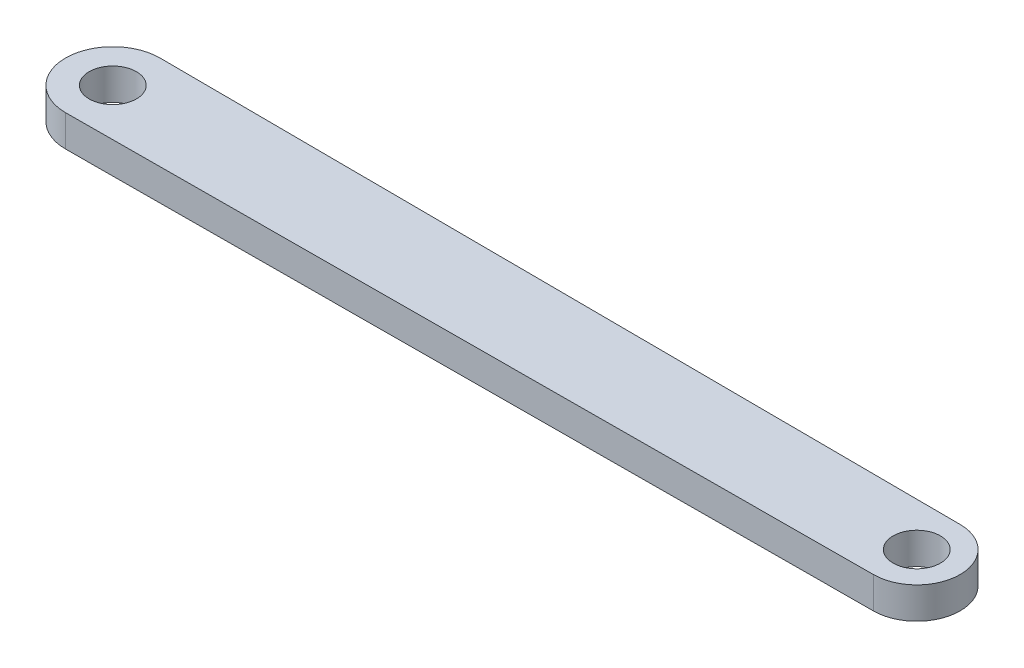
from build123d import *

# Parameters (mm, degrees)
SKETCH1_R           = 1.5
BOSS_EXTRUDE1_DEPTH = 20
SKETCH2_R           = 1.5
BOSS_EXTRUDE2_DEPTH = 1
SKETCH3_R           = 1.5
CUT_EXTRUDE1_DEPTH  = 68.268120235


with BuildPart() as part:
    # Sketch1 → Boss-Extrude1 (new, symmetric)
    with BuildSketch(Plane(origin=(0, 0, 0), x_dir=(1, 0, 0), z_dir=(0, 1, 0))):
        with Locations(Location((0, 0, 0), (0, 0, 270))):
            Circle(SKETCH1_R)
    extrude(amount=BOSS_EXTRUDE1_DEPTH, both=True)

    # Sketch2 → Boss-Extrude2 (add, symmetric)
    with BuildSketch(Plane(origin=(0, 0, 0), x_dir=(1, 0, 0), z_dir=(0, 1, 0))):
        with BuildLine():
            Line((-50.985294118, 2.999963956), (0.013480392, 2.74996696))
            ThreePointArc((0.013480392, 2.74996696), (2.75, 0), (0.013480392, -2.74996696))
            Line((0.013480392, -2.74996696), (-50.985294118, -2.999963956))
            ThreePointArc((-50.985294118, -2.999963956), (-54, 0), (-50.985294118, 2.999963956))
        make_face()
        with Locations(Location((-51, 0, 0), (0, 0, 270))):
            Circle(SKETCH2_R, mode=Mode.SUBTRACT)
    extrude(amount=BOSS_EXTRUDE2_DEPTH, both=True)

    # Sketch3 → Cut-Extrude1 (cut, through all)
    with BuildSketch(Plane(origin=(0, 20, 0), x_dir=(1, 0, 0), z_dir=(0, 1, 0))):
        with Locations(Location((0, 0, 0), (0, 0, 270))):
            Circle(SKETCH3_R)
    extrude(amount=-CUT_EXTRUDE1_DEPTH, mode=Mode.SUBTRACT)


solid = part.part
